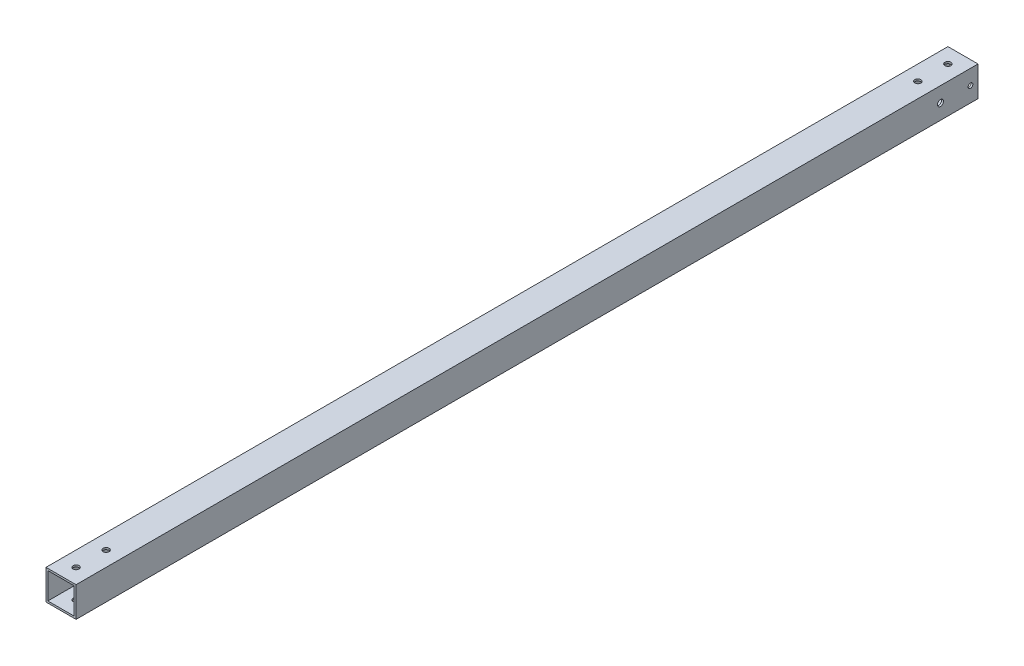
from build123d import *

# Parameters (mm, degrees)
SKETCH1_W           = 25.4
SKETCH1_H           = 25.4
SKETCH1_W_2         = 22.225
SKETCH1_H_2         = 22.225
BOSS_EXTRUDE1_DEPTH = 762
SKETCH3_R           = 2.54
CUT_EXTRUDE2_DEPTH  = 763.846196818
CUT_EXTRUDE3_REACH  = 764.846
SKETCH4_R           = 2.003399785
SKETCH4_R_2         = 2.54
CUT_EXTRUDE4_REACH  = 764.846
SKETCH5_R           = 2.54


with BuildPart() as part:
    # Sketch1 → Boss-Extrude1 (new body)
    with BuildSketch(Plane.XY):
        with Locations((12.7, 12.7)):
            Rectangle(SKETCH1_W, SKETCH1_H)
        with Locations((12.7, 12.7)):
            Rectangle(SKETCH1_W_2, SKETCH1_H_2, mode=Mode.SUBTRACT)
    extrude(amount=BOSS_EXTRUDE1_DEPTH)

    # Sketch3 → Cut-Extrude2 (cut, through all)
    with BuildSketch(Plane(origin=(0, 25.4, 0), x_dir=(1, 0, 0), z_dir=(0, 1, 0))):
        with Locations(Location((12.7, -12.7, 0), (0, 0, 270))):
            Circle(SKETCH3_R)
        with Locations(Location((12.7, -38.1, 0), (0, 0, 270))):
            Circle(SKETCH3_R)
        with Locations(Location((12.7, -723.9, 0), (0, 0, 90))):
            Circle(SKETCH3_R)
        with Locations(Location((12.7, -749.3, 0), (0, 0, 90))):
            Circle(SKETCH3_R)
    extrude(amount=-CUT_EXTRUDE2_DEPTH, mode=Mode.SUBTRACT)

    # Sketch4 → Cut-Extrude3 (cut, up to next)
    with BuildSketch(Plane(origin=(25.4, 0, 0), x_dir=(0, 0, -1), z_dir=(1, 0, 0)), mode=Mode.PRIVATE) as cut_extrude3_sk1:
        with Locations((-6.35, 12.7)):
            Circle(SKETCH4_R)
    cut_extrude3_tool1 = extrude(cut_extrude3_sk1.sketch, amount=-CUT_EXTRUDE3_REACH, mode=Mode.PRIVATE) & part.part
    # Sketch4 → Cut-Extrude3 (cut, up to next)
    with BuildSketch(Plane(origin=(25.4, 0, 0), x_dir=(0, 0, -1), z_dir=(1, 0, 0)), mode=Mode.PRIVATE) as cut_extrude3_sk2:
        with Locations((-31.75, 12.7)):
            Circle(SKETCH4_R_2)
    cut_extrude3_tool2 = extrude(cut_extrude3_sk2.sketch, amount=-CUT_EXTRUDE3_REACH, mode=Mode.PRIVATE) & part.part
    add(cut_extrude3_tool1.solids().sort_by_distance((25.4, 12.7, 6.35))[0], mode=Mode.SUBTRACT)
    add(cut_extrude3_tool2.solids().sort_by_distance((25.4, 12.7, 31.75))[0], mode=Mode.SUBTRACT)

    # Sketch5 → Cut-Extrude4 (cut, up to next)
    with BuildSketch(Plane.ZY, mode=Mode.PRIVATE) as cut_extrude4_sk1:
        with Locations((39.6875, 12.7)):
            Circle(SKETCH5_R)
    cut_extrude4_tool1 = extrude(cut_extrude4_sk1.sketch, amount=-CUT_EXTRUDE4_REACH, mode=Mode.PRIVATE) & part.part
    # Sketch5 → Cut-Extrude4 (cut, up to next)
    with BuildSketch(Plane.ZY, mode=Mode.PRIVATE) as cut_extrude4_sk2:
        with Locations((722.3125, 12.7)):
            Circle(SKETCH5_R)
    cut_extrude4_tool2 = extrude(cut_extrude4_sk2.sketch, amount=-CUT_EXTRUDE4_REACH, mode=Mode.PRIVATE) & part.part
    add(cut_extrude4_tool1.solids().sort_by_distance((0, 12.7, 39.6875))[0], mode=Mode.SUBTRACT)
    add(cut_extrude4_tool2.solids().sort_by_distance((0, 12.7, 722.3125))[0], mode=Mode.SUBTRACT)


solid = part.part
